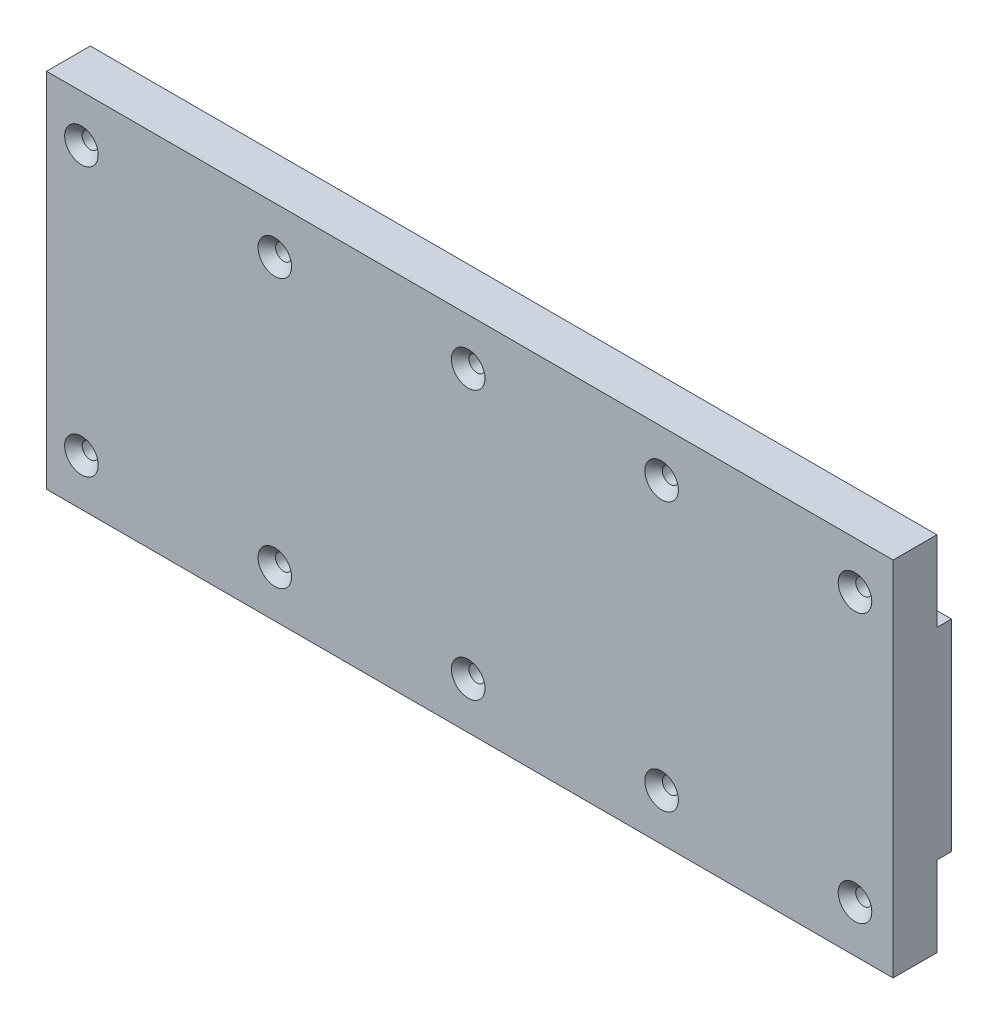
from build123d import *

# Parameters (mm, degrees)
SKETCH1_W           = 40
SKETCH1_H           = 248
BOSS_EXTRUDE1_DEPTH = 580
SKETCH2_W           = 10
SKETCH2_H           = 55
CUT_EXTRUDE1_DEPTH  = 633.06328797
SKETCH3_R           = 5.5
CUT_EXTRUDE2_DEPTH  = 633.06328797
CHAMFER1_SIZE       = 6


with BuildPart() as part:
    # Sketch1 → Boss-Extrude1 (new body)
    with BuildSketch(Plane(origin=(0, 0, 0), x_dir=(0, 0, -1), z_dir=(1, 0, 0))):
        with Locations((20, 124)):
            Rectangle(SKETCH1_W, SKETCH1_H)
    extrude(amount=-BOSS_EXTRUDE1_DEPTH)

    # Sketch2 → Cut-Extrude1 (cut, through all)
    with BuildSketch(Plane(origin=(0, 0, 0), x_dir=(0, 0, -1), z_dir=(1, 0, 0))):
        with Locations((35, 220.5)):
            Rectangle(SKETCH2_W, SKETCH2_H)
        with Locations((35, 27.5)):
            Rectangle(SKETCH2_W, SKETCH2_H)
    extrude(amount=-CUT_EXTRUDE1_DEPTH, mode=Mode.SUBTRACT)

    # Sketch3 → Cut-Extrude2 (cut, through all)
    with BuildSketch(Plane.XY):
        with Locations((-556.095351197, 32)):
            Circle(SKETCH3_R)
        with Locations((-423.595351197, 32)):
            Circle(SKETCH3_R)
        with Locations((-291.095351197, 32)):
            Circle(SKETCH3_R)
        with Locations((-158.595351197, 32)):
            Circle(SKETCH3_R)
        with Locations((-26.095351197, 32)):
            Circle(SKETCH3_R)
        with Locations((-26.095351197, 216)):
            Circle(SKETCH3_R)
        with Locations((-158.595351197, 216)):
            Circle(SKETCH3_R)
        with Locations((-291.095351197, 216)):
            Circle(SKETCH3_R)
        with Locations((-423.595351197, 216)):
            Circle(SKETCH3_R)
        with Locations((-556.095351197, 216)):
            Circle(SKETCH3_R)
    extrude(amount=-CUT_EXTRUDE2_DEPTH, mode=Mode.SUBTRACT)

    # Chamfer1
    chamfer1_edges = [part.edges().sort_by_distance(p)[0] for p in [
        (-561.595351197, 216, 0),
        (-429.095351197, 216, 0),
        (-296.595351197, 216, 0),
        (-164.095351197, 216, 0),
        (-31.595351197, 216, 0),
        (-31.595351197, 32, 0),
        (-164.095351197, 32, 0),
        (-296.595351197, 32, 0),
        (-429.095351197, 32, 0),
        (-561.595351197, 32, 0),
    ]]
    chamfer(chamfer1_edges, length=CHAMFER1_SIZE)


solid = part.part
